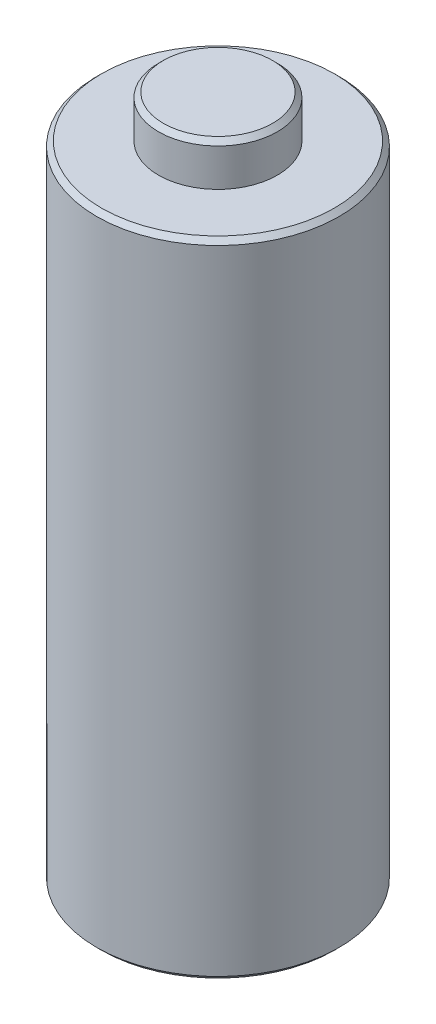
from build123d import *

# Parameters (mm, degrees)
SKETCH1_R           = 2.45
BOSS_EXTRUDE1_DEPTH = 30
CHAMFER1_SIZE       = 0.2
SKETCH2_R           = 5
BOSS_EXTRUDE2_DEPTH = 13.25
CHAMFER2_SIZE       = 0.2


with BuildPart() as part:
    # Sketch1 → Boss-Extrude1 (new body)
    with BuildSketch(Plane(origin=(0, 0, 0), x_dir=(1, 0, 0), z_dir=(0, 1, 0))):
        with Locations(Location((0, 0, 0), (0, 0, 270))):
            Circle(SKETCH1_R)
    extrude(amount=BOSS_EXTRUDE1_DEPTH)

    # Chamfer1
    chamfer1_edges = [part.edges().sort_by_distance(p)[0] for p in [
        (0, 0, -2.45),
        (0, 30, -2.45),
    ]]
    chamfer(chamfer1_edges, length=CHAMFER1_SIZE)

    # Sketch2 → Boss-Extrude2 (add, symmetric)
    with BuildSketch(Plane(origin=(0, 15, 0), x_dir=(1, 0, 0), z_dir=(0, 1, 0))):
        with Locations(Location((0, 0, 0), (0, 0, 270))):
            Circle(SKETCH2_R)
    extrude(amount=BOSS_EXTRUDE2_DEPTH, both=True)

    # Chamfer2
    chamfer2_edges = [part.edges().sort_by_distance(p)[0] for p in [
        (0, 1.75, -5),
        (0, 28.25, -5),
    ]]
    chamfer(chamfer2_edges, length=CHAMFER2_SIZE)


solid = part.part
